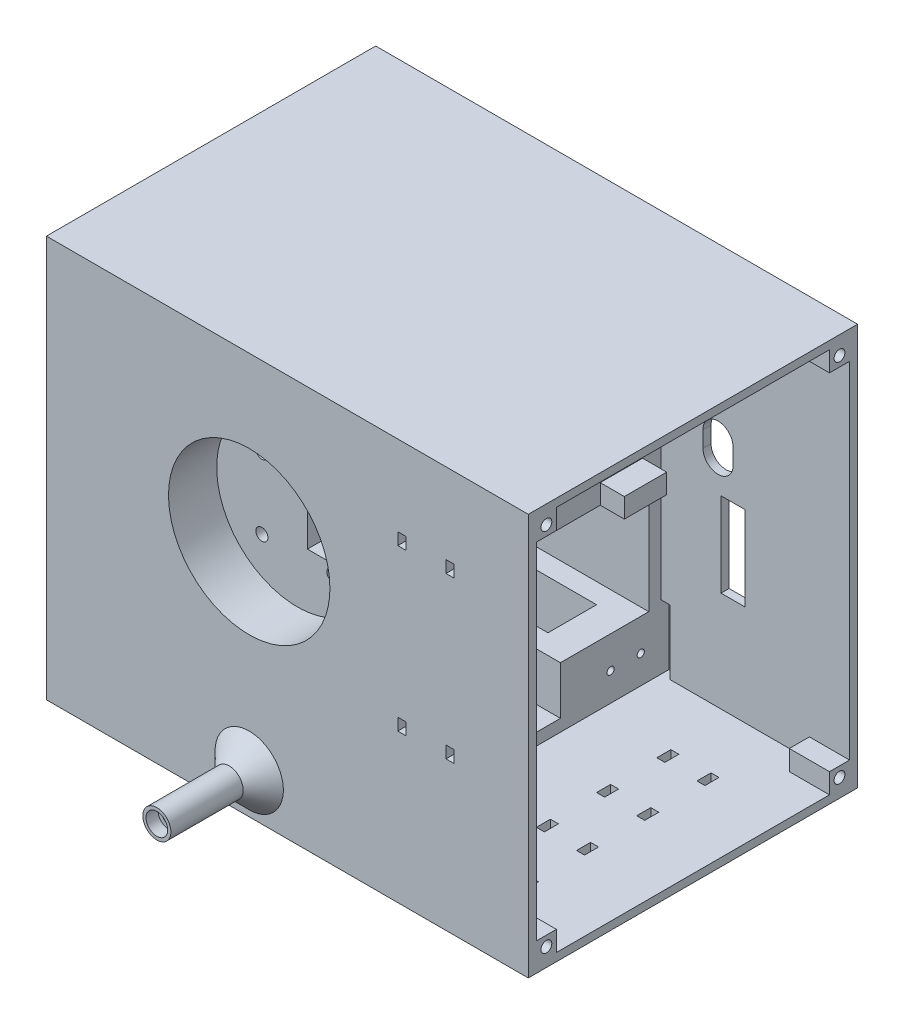
from build123d import *

# Parameters (mm, degrees)
ESQUISSE1_W              = 45
ESQUISSE1_H              = 100
ESQUISSE1_R              = 20.1
BOSS_EXTRU_1_DEPTH       = 12
ESQUISSE1_3_W            = 45
ESQUISSE1_3_H            = 100
ESQUISSE1_3_R            = 1.5
BOSS_EXTRU_4_DEPTH       = 5
ESQUISSE4_W              = 45
ESQUISSE4_H              = 100
ESQUISSE4_R              = 3.5
ESQUISSE4_W_2            = 20
ESQUISSE4_H_2            = 20
BOSS_EXTRU_5_DEPTH       = 65
ESQUISSE6_W              = 29
ESQUISSE6_H              = 12.1
ENL_V_MAT_EXTRU_1_DEPTH  = 46
ESQUISSE7_W              = 82
ESQUISSE7_H              = 100
ESQUISSE7_W_2            = 78
ESQUISSE7_H_2            = 96
BOSS_EXTRU_6_DEPTH       = 28
ESQUISSE8_W              = 82
ESQUISSE8_H              = 100
ESQUISSE8_W_2            = 78
ESQUISSE8_H_2            = 96
BOSS_EXTRU_7_DEPTH       = 47
ESQUISSE9_W              = 10
ESQUISSE9_H              = 12.5
ENL_V_MAT_EXTRU_2_DEPTH  = 20
ENL_V_MAT_EXTRU_3_REACH  = 119.176
ESQUISSE10_W             = 2
ESQUISSE10_H             = 3
ENL_V_MAT_EXTRU_4_DEPTH  = 40
ENL_V_MAT_EXTRU_5_REACH  = 124.348
ESQUISSE12_W             = 50
ESQUISSE12_H             = 13
ENL_V_MAT_EXTRU_6_REACH  = 142.464
ESQUISSE13_W             = 2
ESQUISSE13_H             = 3.5
ESQUISSE14_R             = 3.5
ESQUISSE14_R_2           = 1.375
BOSS_EXTRU_8_DEPTH       = 6
ESQUISSE15_W             = 10.534212967
ESQUISSE15_H             = 4.874005284
ESQUISSE15_W_2           = 8.678766354
ESQUISSE15_H_2           = 10.103529846
BOSS_EXTRU_9_DEPTH       = 6
ENL_V_MAT_EXTRU_7_REACH  = 119.176
ESQUISSE17_W             = 6
ESQUISSE17_H             = 21
ESQUISSE19_R             = 3.5
ESQUISSE19_R_2           = 1.7
BOSS_EXTRU_10_DEPTH      = 23
ENL_V_MAT_EXTRU_8_REACH  = 120.551
ESQUISSE19_2_R           = 1.7
ESQUISSE20_R             = 2.7
ENL_V_MAT_EXTRU_9_DEPTH  = 3
ENL_V_MAT_EXTRU_10_DEPTH = 2.5
CHANFREIN1_SIZE          = 5
ENL_V_MAT_EXTRU_11_DEPTH = 2
ESQUISSE24_W             = 5.5
ESQUISSE24_H             = 80
BOSS_EXTRU_11_DEPTH      = 28
ESQUISSE25_W             = 5
ESQUISSE25_H             = 7
ENL_V_MAT_EXTRU_12_DEPTH = 2
ESQUISSE26_W             = 2.3
ESQUISSE26_H             = 16.1
ENL_V_MAT_EXTRU_13_DEPTH = 2
ESQUISSE27_R             = 0.9
ENL_V_MAT_EXTRU_14_DEPTH = 8
ESQUISSE28_W             = 5
ESQUISSE28_H             = 5
ESQUISSE28_R             = 1.35
BOSS_EXTRU_12_DEPTH      = 10
ENL_V_START              = -10
ESQUISSE29_R             = 1.35
ENL_V_MAT_EXTRU_15_DEPTH = 10
ENL_V_MAT_EXTRU_16_REACH = 137.482
ESQUISSE30_R             = 1.7
BOSS_EXTRU_13_DEPTH      = 3
ENL_V_MAT_EXTRU_17_DEPTH = 4


with BuildPart() as part:
    # Esquisse1 → Boss.-Extru.1 (new body)
    with BuildSketch(Plane.XY):
        Rectangle(ESQUISSE1_W, ESQUISSE1_H)
        with Locations((0, 9.361165235)):
            Circle(ESQUISSE1_R, mode=Mode.SUBTRACT)
    extrude(amount=BOSS_EXTRU_1_DEPTH)

    # Esquisse1<3> → Boss.-Extru.4 (add)
    with BuildSketch(Plane.XY):
        Rectangle(ESQUISSE1_3_W, ESQUISSE1_3_H)
        with Locations((8.838834765, 18.2)):
            Circle(ESQUISSE1_3_R, mode=Mode.SUBTRACT)
        with Locations((8.838834765, 0.52233047)):
            Circle(ESQUISSE1_3_R, mode=Mode.SUBTRACT)
        with Locations((-8.838834765, 18.2)):
            Circle(ESQUISSE1_3_R, mode=Mode.SUBTRACT)
        with Locations((-8.838834765, 0.52233047)):
            Circle(ESQUISSE1_3_R, mode=Mode.SUBTRACT)
    extrude(amount=-BOSS_EXTRU_4_DEPTH)

    # Esquisse4 → Boss.-Extru.5 (add)
    with BuildSketch(Plane(origin=(0, 0, -5), x_dir=(-1, 0, 0), z_dir=(0, 0, -1))):
        Rectangle(ESQUISSE4_W, ESQUISSE4_H)
        with Locations((8.838834765, 18.2)):
            Circle(ESQUISSE4_R, mode=Mode.SUBTRACT)
        with Locations((8.838834765, 0.52233047)):
            Circle(ESQUISSE4_R, mode=Mode.SUBTRACT)
        with Locations((-8.838834765, 0.52233047)):
            Circle(ESQUISSE4_R, mode=Mode.SUBTRACT)
        with Locations((-8.838834765, 18.2)):
            Circle(ESQUISSE4_R, mode=Mode.SUBTRACT)
        with Locations((0, 35)):
            Rectangle(ESQUISSE4_W_2, ESQUISSE4_H_2, mode=Mode.SUBTRACT)
    extrude(amount=BOSS_EXTRU_5_DEPTH)

    # Esquisse6 → Enlèv. mat.-Extru.1 (cut)
    with BuildSketch(Plane.XZ.offset(50)):
        with Locations((0, -53.95)):
            Rectangle(ESQUISSE6_W, ESQUISSE6_H)
    extrude(amount=-ENL_V_MAT_EXTRU_1_DEPTH, mode=Mode.SUBTRACT)

    # Esquisse7 → Boss.-Extru.6 (add)
    with BuildSketch(Plane.ZY.offset(22.5)):
        with Locations((-29, 0)):
            Rectangle(ESQUISSE7_W, ESQUISSE7_H)
        with Locations((-29, 0)):
            Rectangle(ESQUISSE7_W_2, ESQUISSE7_H_2, mode=Mode.SUBTRACT)
    extrude(amount=BOSS_EXTRU_6_DEPTH)

    # Esquisse8 → Boss.-Extru.7 (add)
    with BuildSketch(Plane(origin=(22.5, 0, 0), x_dir=(0, 0, -1), z_dir=(1, 0, 0))):
        with Locations((29, 0)):
            Rectangle(ESQUISSE8_W, ESQUISSE8_H)
        with Locations((29, 0)):
            Rectangle(ESQUISSE8_W_2, ESQUISSE8_H_2, mode=Mode.SUBTRACT)
    extrude(amount=BOSS_EXTRU_7_DEPTH)

    # Esquisse9 → Enlèv. mat.-Extru.2 (cut)
    with BuildSketch(Plane(origin=(22.5, 0, 0), x_dir=(0, 0, -1), z_dir=(1, 0, 0))):
        with Locations((1, 9.25)):
            Rectangle(ESQUISSE9_W, ESQUISSE9_H)
    extrude(amount=-ENL_V_MAT_EXTRU_2_DEPTH, mode=Mode.SUBTRACT)

    # Esquisse10 → Enlèv. mat.-Extru.3 (cut, up to next)
    with BuildSketch(Plane(origin=(0, 0, 10), x_dir=(-1, 0, 0), z_dir=(0, 0, -1)), mode=Mode.PRIVATE) as enl_v_mat_extru_3_sk1:
        with Locations((-50, -11.5)):
            Rectangle(ESQUISSE10_W, ESQUISSE10_H)
    enl_v_mat_extru_3_tool1 = extrude(enl_v_mat_extru_3_sk1.sketch, amount=-ENL_V_MAT_EXTRU_3_REACH, mode=Mode.PRIVATE) & part.part
    # Esquisse10 → Enlèv. mat.-Extru.3 (cut, up to next)
    with BuildSketch(Plane(origin=(0, 0, 10), x_dir=(-1, 0, 0), z_dir=(0, 0, -1)), mode=Mode.PRIVATE) as enl_v_mat_extru_3_sk2:
        with Locations((-50, 28.5)):
            Rectangle(ESQUISSE10_W, ESQUISSE10_H)
    enl_v_mat_extru_3_tool2 = extrude(enl_v_mat_extru_3_sk2.sketch, amount=-ENL_V_MAT_EXTRU_3_REACH, mode=Mode.PRIVATE) & part.part
    # Esquisse10 → Enlèv. mat.-Extru.3 (cut, up to next)
    with BuildSketch(Plane(origin=(0, 0, 10), x_dir=(-1, 0, 0), z_dir=(0, 0, -1)), mode=Mode.PRIVATE) as enl_v_mat_extru_3_sk3:
        with Locations((-38, -11.5)):
            Rectangle(ESQUISSE10_W, ESQUISSE10_H)
    enl_v_mat_extru_3_tool3 = extrude(enl_v_mat_extru_3_sk3.sketch, amount=-ENL_V_MAT_EXTRU_3_REACH, mode=Mode.PRIVATE) & part.part
    # Esquisse10 → Enlèv. mat.-Extru.3 (cut, up to next)
    with BuildSketch(Plane(origin=(0, 0, 10), x_dir=(-1, 0, 0), z_dir=(0, 0, -1)), mode=Mode.PRIVATE) as enl_v_mat_extru_3_sk4:
        with Locations((-38, 28.5)):
            Rectangle(ESQUISSE10_W, ESQUISSE10_H)
    enl_v_mat_extru_3_tool4 = extrude(enl_v_mat_extru_3_sk4.sketch, amount=-ENL_V_MAT_EXTRU_3_REACH, mode=Mode.PRIVATE) & part.part
    add(enl_v_mat_extru_3_tool1.solids().sort_by_distance((50, -11.5, 10))[0], mode=Mode.SUBTRACT)
    add(enl_v_mat_extru_3_tool2.solids().sort_by_distance((50, 28.5, 10))[0], mode=Mode.SUBTRACT)
    add(enl_v_mat_extru_3_tool3.solids().sort_by_distance((38, -11.5, 10))[0], mode=Mode.SUBTRACT)
    add(enl_v_mat_extru_3_tool4.solids().sort_by_distance((38, 28.5, 10))[0], mode=Mode.SUBTRACT)

    # Esquisse11 → Enlèv. mat.-Extru.4 (cut)
    with BuildSketch(Plane(origin=(22.5, 0, 0), x_dir=(0, 0, -1), z_dir=(1, 0, 0))):
        Polygon((-7, -45), (43, -45), (43, -33), (65, -33), (65, -4), (18, -4), (18, -20), (-7, -20), align=None)
    extrude(amount=-ENL_V_MAT_EXTRU_4_DEPTH, mode=Mode.SUBTRACT)

    # Esquisse12 → Enlèv. mat.-Extru.5 (cut, up to next)
    with BuildSketch(Plane(origin=(-17.5, 0, 0), x_dir=(0, 0, -1), z_dir=(1, 0, 0)), mode=Mode.PRIVATE) as enl_v_mat_extru_5_sk1:
        with Locations((18, -38.5)):
            Rectangle(ESQUISSE12_W, ESQUISSE12_H)
    enl_v_mat_extru_5_tool1 = extrude(enl_v_mat_extru_5_sk1.sketch, amount=-ENL_V_MAT_EXTRU_5_REACH, mode=Mode.PRIVATE) & part.part
    add(enl_v_mat_extru_5_tool1.solids().sort_by_distance((-17.5, -38.5, -18))[0], mode=Mode.SUBTRACT)

    # Esquisse13 → Enlèv. mat.-Extru.6 (cut, up to next)
    with BuildSketch(Plane.XZ.offset(50), mode=Mode.PRIVATE) as enl_v_mat_extru_6_sk1:
        with Locations((51, -36.25)):
            Rectangle(ESQUISSE13_W, ESQUISSE13_H)
    enl_v_mat_extru_6_tool1 = extrude(enl_v_mat_extru_6_sk1.sketch, amount=-ENL_V_MAT_EXTRU_6_REACH, mode=Mode.PRIVATE) & part.part
    # Esquisse13 → Enlèv. mat.-Extru.6 (cut, up to next)
    with BuildSketch(Plane.XZ.offset(50), mode=Mode.PRIVATE) as enl_v_mat_extru_6_sk2:
        with Locations((51, -51.25)):
            Rectangle(ESQUISSE13_W, ESQUISSE13_H)
    enl_v_mat_extru_6_tool2 = extrude(enl_v_mat_extru_6_sk2.sketch, amount=-ENL_V_MAT_EXTRU_6_REACH, mode=Mode.PRIVATE) & part.part
    # Esquisse13 → Enlèv. mat.-Extru.6 (cut, up to next)
    with BuildSketch(Plane.XZ.offset(50), mode=Mode.PRIVATE) as enl_v_mat_extru_6_sk3:
        with Locations((51, -21.25)):
            Rectangle(ESQUISSE13_W, ESQUISSE13_H)
    enl_v_mat_extru_6_tool3 = extrude(enl_v_mat_extru_6_sk3.sketch, amount=-ENL_V_MAT_EXTRU_6_REACH, mode=Mode.PRIVATE) & part.part
    # Esquisse13 → Enlèv. mat.-Extru.6 (cut, up to next)
    with BuildSketch(Plane.XZ.offset(50), mode=Mode.PRIVATE) as enl_v_mat_extru_6_sk4:
        with Locations((51, -6.25)):
            Rectangle(ESQUISSE13_W, ESQUISSE13_H)
    enl_v_mat_extru_6_tool4 = extrude(enl_v_mat_extru_6_sk4.sketch, amount=-ENL_V_MAT_EXTRU_6_REACH, mode=Mode.PRIVATE) & part.part
    # Esquisse13 → Enlèv. mat.-Extru.6 (cut, up to next)
    with BuildSketch(Plane.XZ.offset(50), mode=Mode.PRIVATE) as enl_v_mat_extru_6_sk5:
        with Locations((41, -6.25)):
            Rectangle(ESQUISSE13_W, ESQUISSE13_H)
    enl_v_mat_extru_6_tool5 = extrude(enl_v_mat_extru_6_sk5.sketch, amount=-ENL_V_MAT_EXTRU_6_REACH, mode=Mode.PRIVATE) & part.part
    # Esquisse13 → Enlèv. mat.-Extru.6 (cut, up to next)
    with BuildSketch(Plane.XZ.offset(50), mode=Mode.PRIVATE) as enl_v_mat_extru_6_sk6:
        with Locations((41, -21.25)):
            Rectangle(ESQUISSE13_W, ESQUISSE13_H)
    enl_v_mat_extru_6_tool6 = extrude(enl_v_mat_extru_6_sk6.sketch, amount=-ENL_V_MAT_EXTRU_6_REACH, mode=Mode.PRIVATE) & part.part
    # Esquisse13 → Enlèv. mat.-Extru.6 (cut, up to next)
    with BuildSketch(Plane.XZ.offset(50), mode=Mode.PRIVATE) as enl_v_mat_extru_6_sk7:
        with Locations((41, -36.25)):
            Rectangle(ESQUISSE13_W, ESQUISSE13_H)
    enl_v_mat_extru_6_tool7 = extrude(enl_v_mat_extru_6_sk7.sketch, amount=-ENL_V_MAT_EXTRU_6_REACH, mode=Mode.PRIVATE) & part.part
    # Esquisse13 → Enlèv. mat.-Extru.6 (cut, up to next)
    with BuildSketch(Plane.XZ.offset(50), mode=Mode.PRIVATE) as enl_v_mat_extru_6_sk8:
        with Locations((41, -51.25)):
            Rectangle(ESQUISSE13_W, ESQUISSE13_H)
    enl_v_mat_extru_6_tool8 = extrude(enl_v_mat_extru_6_sk8.sketch, amount=-ENL_V_MAT_EXTRU_6_REACH, mode=Mode.PRIVATE) & part.part
    add(enl_v_mat_extru_6_tool1.solids().sort_by_distance((51, -50, -36.25))[0], mode=Mode.SUBTRACT)
    add(enl_v_mat_extru_6_tool2.solids().sort_by_distance((51, -50, -51.25))[0], mode=Mode.SUBTRACT)
    add(enl_v_mat_extru_6_tool3.solids().sort_by_distance((51, -50, -21.25))[0], mode=Mode.SUBTRACT)
    add(enl_v_mat_extru_6_tool4.solids().sort_by_distance((51, -50, -6.25))[0], mode=Mode.SUBTRACT)
    add(enl_v_mat_extru_6_tool5.solids().sort_by_distance((41, -50, -6.25))[0], mode=Mode.SUBTRACT)
    add(enl_v_mat_extru_6_tool6.solids().sort_by_distance((41, -50, -21.25))[0], mode=Mode.SUBTRACT)
    add(enl_v_mat_extru_6_tool7.solids().sort_by_distance((41, -50, -36.25))[0], mode=Mode.SUBTRACT)
    add(enl_v_mat_extru_6_tool8.solids().sort_by_distance((41, -50, -51.25))[0], mode=Mode.SUBTRACT)

    # Esquisse14 → Boss.-Extru.8 (add)
    # profile 1 of 2: a face of its own
    with BuildSketch(Plane(origin=(22.5, 0, 0), x_dir=(0, 0, -1), z_dir=(1, 0, 0))):
        with Locations(Location((14, -12, 0), (0, 0, 90))):
            Circle(ESQUISSE14_R)
        with Locations(Location((14, -12, 0), (0, 0, 90))):
            Circle(ESQUISSE14_R_2, mode=Mode.SUBTRACT)
    # profile 2 of 2: a face of its own
    with BuildSketch(Plane(origin=(22.5, 0, 0), x_dir=(0, 0, -1), z_dir=(1, 0, 0))):
        with Locations(Location((60, 38, 0), (0, 0, 90))):
            Circle(ESQUISSE14_R)
        with Locations(Location((60, 38, 0), (0, 0, 90))):
            Circle(ESQUISSE14_R_2, mode=Mode.SUBTRACT)
    extrude(amount=BOSS_EXTRU_8_DEPTH)

    # Esquisse15 → Boss.-Extru.9 (add)
    with BuildSketch(Plane(origin=(22.5, 0, 0), x_dir=(0, 0, -1), z_dir=(1, 0, 0))):
        with Locations((58.187333922, -1.562997358)):
            Rectangle(ESQUISSE15_W, ESQUISSE15_H)
        with Locations((15.339383177, 35.948235077)):
            Rectangle(ESQUISSE15_W_2, ESQUISSE15_H_2)
    extrude(amount=BOSS_EXTRU_9_DEPTH)

    # Esquisse17 → Enlèv. mat.-Extru.7 (cut, up to next)
    with BuildSketch(Plane.XY.offset(-68), mode=Mode.PRIVATE) as enl_v_mat_extru_7_sk1:
        with Locations((40.5, -12.5)):
            Rectangle(ESQUISSE17_W, ESQUISSE17_H)
    enl_v_mat_extru_7_tool1 = extrude(enl_v_mat_extru_7_sk1.sketch, amount=-ENL_V_MAT_EXTRU_7_REACH, mode=Mode.PRIVATE) & part.part
    add(enl_v_mat_extru_7_tool1.solids().sort_by_distance((40.5, -12.5, -68))[0], mode=Mode.SUBTRACT)

    # Esquisse19 → Boss.-Extru.10 (add)
    with BuildSketch(Plane.XY.offset(12)):
        with Locations((0, -40)):
            Circle(ESQUISSE19_R)
        with Locations((0, -40)):
            Circle(ESQUISSE19_R_2, mode=Mode.SUBTRACT)
    extrude(amount=BOSS_EXTRU_10_DEPTH)

    # Esquisse19<2> → Enlèv. mat.-Extru.8 (cut, up to next)
    with BuildSketch(Plane.XY.offset(12), mode=Mode.PRIVATE) as enl_v_mat_extru_8_sk1:
        with Locations(Location((0, -40, 0), (0, 0, 270))):
            Circle(ESQUISSE19_2_R)
    enl_v_mat_extru_8_tool1 = extrude(enl_v_mat_extru_8_sk1.sketch, amount=-ENL_V_MAT_EXTRU_8_REACH, mode=Mode.PRIVATE) & part.part
    add(enl_v_mat_extru_8_tool1.solids().sort_by_distance((0, -40, 12))[0], mode=Mode.SUBTRACT)

    # Esquisse20 → Enlèv. mat.-Extru.9 (cut)
    with BuildSketch(Plane.XY.offset(35)):
        with Locations((0, -40)):
            Circle(ESQUISSE20_R)
    extrude(amount=-ENL_V_MAT_EXTRU_9_DEPTH, mode=Mode.SUBTRACT)

    # Esquisse21 → Enlèv. mat.-Extru.10 (cut)
    with BuildSketch(Plane(origin=(0, 0, 7), x_dir=(-1, 0, 0), z_dir=(0, 0, -1))):
        Polygon((-1.616580754, -42.8), (1.616580754, -42.8), (3.233161507, -40), (1.616580754, -37.2), (-1.616580754, -37.2), (-3.233161507, -40), align=None)
    extrude(amount=-ENL_V_MAT_EXTRU_10_DEPTH, mode=Mode.SUBTRACT)

    # Chanfrein1
    chanfrein1_edges = [part.edges().sort_by_distance(p)[0] for p in [
        (-3.5, -40, 12),
    ]]
    chamfer(chanfrein1_edges, length=CHANFREIN1_SIZE)

    # Esquisse23 → Enlèv. mat.-Extru.11 (cut)
    with BuildSketch(Plane(origin=(0, 0, -70), x_dir=(-1, 0, 0), z_dir=(0, 0, -1))):
        with BuildLine():
            ThreePointArc((-33, 10), (-34.098349571, 12.651650429), (-36.75, 13.75))
            ThreePointArc((-36.75, 13.75), (-39.401650429, 12.651650429), (-40.5, 10))
            Line((-40.5, 10), (-40.5, 8))
            Line((-40.5, 8), (-33, 8))
            Line((-33, 8), (-33, 10))
        make_face()
        with BuildLine():
            Line((-33, 8), (-40.5, 8))
            Line((-40.5, 8), (-40.5, 6))
            ThreePointArc((-40.5, 6), (-39.401650429, 3.348349571), (-36.75, 2.25))
            ThreePointArc((-36.75, 2.25), (-34.098349571, 3.348349571), (-33, 6))
            Line((-33, 6), (-33, 8))
        make_face()
    extrude(amount=-ENL_V_MAT_EXTRU_11_DEPTH, mode=Mode.SUBTRACT)

    # Esquisse24 → Boss.-Extru.11 (add)
    with BuildSketch(Plane.ZY.offset(22.5)):
        with Locations((7.25, 8)):
            Rectangle(ESQUISSE24_W, ESQUISSE24_H)
        with Locations((-65.25, 8)):
            Rectangle(ESQUISSE24_W, ESQUISSE24_H)
    extrude(amount=BOSS_EXTRU_11_DEPTH)

    # Esquisse25 → Enlèv. mat.-Extru.12 (cut)
    with BuildSketch(Plane.XY.offset(-68)):
        with Locations((-48, -44.5)):
            Rectangle(ESQUISSE25_W, ESQUISSE25_H)
    extrude(amount=-ENL_V_MAT_EXTRU_12_DEPTH, mode=Mode.SUBTRACT)

    # Esquisse26 → Enlèv. mat.-Extru.13 (cut)
    with BuildSketch(Plane(origin=(0, 0, -70), x_dir=(-1, 0, 0), z_dir=(0, 0, -1))):
        with Locations((-23.65, -39.95)):
            Rectangle(ESQUISSE26_W, ESQUISSE26_H)
    extrude(amount=-ENL_V_MAT_EXTRU_13_DEPTH, mode=Mode.SUBTRACT)

    # Esquisse27 → Enlèv. mat.-Extru.14 (cut)
    with BuildSketch(Plane(origin=(22.5, 0, 0), x_dir=(0, 0, -1), z_dir=(1, 0, 0))):
        with Locations(Location((63, -41, 0), (0, 0, 90))):
            Circle(ESQUISSE27_R)
        with Locations(Location((55.5, -41, 0), (0, 0, 90))):
            Circle(ESQUISSE27_R)
    extrude(amount=-ENL_V_MAT_EXTRU_14_DEPTH, mode=Mode.SUBTRACT)

    # Esquisse28 → Boss.-Extru.12 (add)
    # profile 1 of 4: a face of its own
    with BuildSketch(Plane(origin=(69.5, 0, 0), x_dir=(0, 0, -1), z_dir=(1, 0, 0))):
        with Locations((-7.5, -45.5)):
            Rectangle(ESQUISSE28_W, ESQUISSE28_H)
        with Locations(Location((-7.5, -45.5, 0), (0, 0, 90))):
            Circle(ESQUISSE28_R, mode=Mode.SUBTRACT)
    # profile 2 of 4: a face of its own
    with BuildSketch(Plane(origin=(69.5, 0, 0), x_dir=(0, 0, -1), z_dir=(1, 0, 0))):
        with Locations((-7.5, 45.5)):
            Rectangle(ESQUISSE28_W, ESQUISSE28_H)
        with Locations(Location((-7.5, 45.5, 0), (0, 0, 90))):
            Circle(ESQUISSE28_R, mode=Mode.SUBTRACT)
    # profile 3 of 4: a face of its own
    with BuildSketch(Plane(origin=(69.5, 0, 0), x_dir=(0, 0, -1), z_dir=(1, 0, 0))):
        with Locations((65.5, 45.5)):
            Rectangle(ESQUISSE28_W, ESQUISSE28_H)
        with Locations(Location((65.5, 45.5, 0), (0, 0, 90))):
            Circle(ESQUISSE28_R, mode=Mode.SUBTRACT)
    # profile 4 of 4: a face of its own
    with BuildSketch(Plane(origin=(69.5, 0, 0), x_dir=(0, 0, -1), z_dir=(1, 0, 0))):
        with Locations((65.5, -45.5)):
            Rectangle(ESQUISSE28_W, ESQUISSE28_H)
        with Locations(Location((65.5, -45.5, 0), (0, 0, 90))):
            Circle(ESQUISSE28_R, mode=Mode.SUBTRACT)
    extrude(amount=-BOSS_EXTRU_12_DEPTH)

    # Esquisse29 → Enlèv. mat.-Extru.15 (cut)
    with BuildSketch(Plane.ZY.offset(50.5).offset(ENL_V_START)):
        with Locations(Location((7.5, 45.5, 0), (0, 0, 90))):
            Circle(ESQUISSE29_R)
        with Locations(Location((-65.5, 45.5, 0), (0, 0, 90))):
            Circle(ESQUISSE29_R)
        with Locations(Location((-65.5, -29.5, 0), (0, 0, 270))):
            Circle(ESQUISSE29_R)
        with Locations(Location((7.5, -29.5, 0), (0, 0, 270))):
            Circle(ESQUISSE29_R)
    extrude(amount=ENL_V_MAT_EXTRU_15_DEPTH, mode=Mode.SUBTRACT)

    # Esquisse30 → Enlèv. mat.-Extru.16 (cut, up to next)
    with BuildSketch(Plane(origin=(0, 0, -70), x_dir=(-1, 0, 0), z_dir=(0, 0, -1)), mode=Mode.PRIVATE) as enl_v_mat_extru_16_sk1:
        with Locations((27.5, 45.3)):
            Circle(ESQUISSE30_R)
    enl_v_mat_extru_16_tool1 = extrude(enl_v_mat_extru_16_sk1.sketch, amount=-ENL_V_MAT_EXTRU_16_REACH, mode=Mode.PRIVATE) & part.part
    # Esquisse30 → Enlèv. mat.-Extru.16 (cut, up to next)
    with BuildSketch(Plane(origin=(0, 0, -70), x_dir=(-1, 0, 0), z_dir=(0, 0, -1)), mode=Mode.PRIVATE) as enl_v_mat_extru_16_sk2:
        with Locations((27.5, 24.7)):
            Circle(ESQUISSE30_R)
    enl_v_mat_extru_16_tool2 = extrude(enl_v_mat_extru_16_sk2.sketch, amount=-ENL_V_MAT_EXTRU_16_REACH, mode=Mode.PRIVATE) & part.part
    # Esquisse30 → Enlèv. mat.-Extru.16 (cut, up to next)
    with BuildSketch(Plane(origin=(0, 0, -70), x_dir=(-1, 0, 0), z_dir=(0, 0, -1)), mode=Mode.PRIVATE) as enl_v_mat_extru_16_sk3:
        with Locations((-27.5, 24.7)):
            Circle(ESQUISSE30_R)
    enl_v_mat_extru_16_tool3 = extrude(enl_v_mat_extru_16_sk3.sketch, amount=-ENL_V_MAT_EXTRU_16_REACH, mode=Mode.PRIVATE) & part.part
    # Esquisse30 → Enlèv. mat.-Extru.16 (cut, up to next)
    with BuildSketch(Plane(origin=(0, 0, -70), x_dir=(-1, 0, 0), z_dir=(0, 0, -1)), mode=Mode.PRIVATE) as enl_v_mat_extru_16_sk4:
        with Locations((-27.5, 45.3)):
            Circle(ESQUISSE30_R)
    enl_v_mat_extru_16_tool4 = extrude(enl_v_mat_extru_16_sk4.sketch, amount=-ENL_V_MAT_EXTRU_16_REACH, mode=Mode.PRIVATE) & part.part
    add(enl_v_mat_extru_16_tool1.solids().sort_by_distance((-27.5, 45.3, -70))[0], mode=Mode.SUBTRACT)
    add(enl_v_mat_extru_16_tool2.solids().sort_by_distance((-27.5, 24.7, -70))[0], mode=Mode.SUBTRACT)
    add(enl_v_mat_extru_16_tool3.solids().sort_by_distance((27.5, 24.7, -70))[0], mode=Mode.SUBTRACT)
    add(enl_v_mat_extru_16_tool4.solids().sort_by_distance((27.5, 45.3, -70))[0], mode=Mode.SUBTRACT)

    # Esquisse31 → Boss.-Extru.13 (add)
    with BuildSketch(Plane.XY.offset(-68)):
        Polygon((32.5, 29), (22.5, 29), (22.5, 22), (25.941154273, 22), (24.382308546, 24.7), (25.941154273, 27.4), (29.058845727, 27.4), (30.617691454, 24.7), (29.058845727, 22), (32.5, 22), align=None)
        Polygon((25.941154273, 22), (22.5, 22), (22.5, 20.4), (32.5, 20.4), (32.5, 22), (29.058845727, 22), align=None)
        Polygon((25.941154273, 48), (22.5, 48), (22.5, 41), (32.5, 41), (32.5, 48), (29.058845727, 48), (30.617691454, 45.3), (29.058845727, 42.6), (25.941154273, 42.6), (24.382308546, 45.3), align=None)
    extrude(amount=BOSS_EXTRU_13_DEPTH)

    # Esquisse32 → Enlèv. mat.-Extru.17 (cut)
    with BuildSketch(Plane.XY.offset(-62.5)):
        Polygon((-29.058845727, 48), (-30.617691454, 45.3), (-29.058845727, 42.6), (-25.941154273, 42.6), (-24.382308546, 45.3), (-25.941154273, 48), align=None)
        Polygon((-25.941154273, 22), (-29.058845727, 22), (-30.617691454, 24.7), (-29.058845727, 27.4), (-25.941154273, 27.4), (-24.382308546, 24.7), align=None)
    extrude(amount=-ENL_V_MAT_EXTRU_17_DEPTH, mode=Mode.SUBTRACT)


solid = part.part
